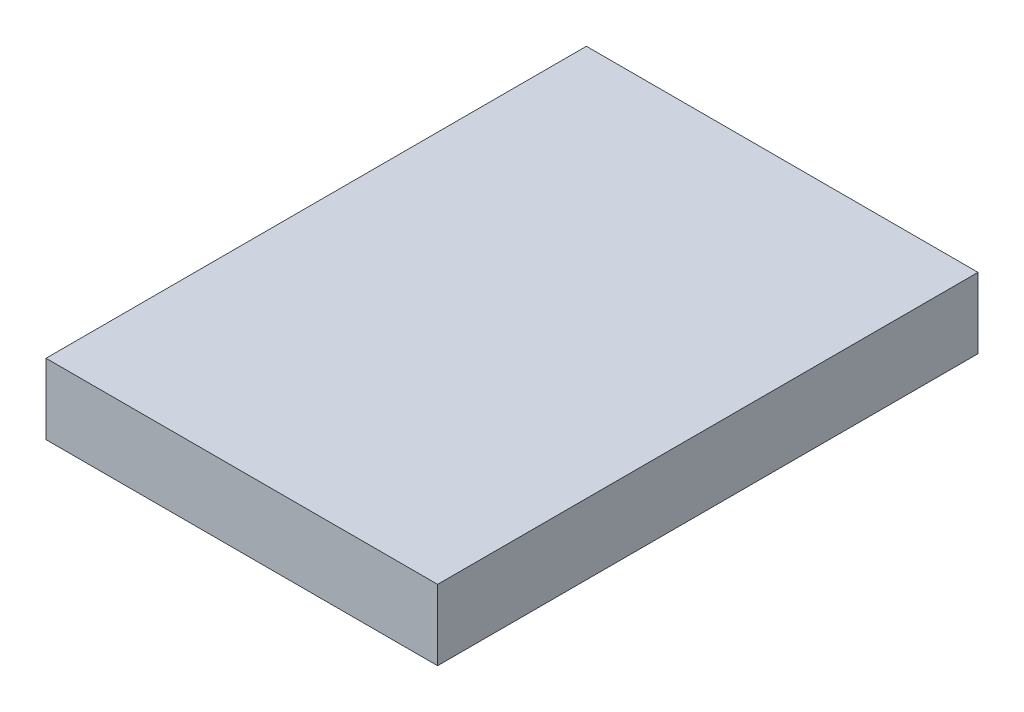
from build123d import *

# Parameters (mm, degrees)
SKETCH1_W           = 25
SKETCH1_H           = 34.5
BOSS_EXTRUDE1_DEPTH = 4.5


with BuildPart() as part:
    # Sketch1 → Boss-Extrude1 (new body)
    with BuildSketch(Plane(origin=(0, 0, 0), x_dir=(1, 0, 0), z_dir=(0, 1, 0))):
        Rectangle(SKETCH1_W, SKETCH1_H)
    extrude(amount=BOSS_EXTRUDE1_DEPTH)


solid = part.part
